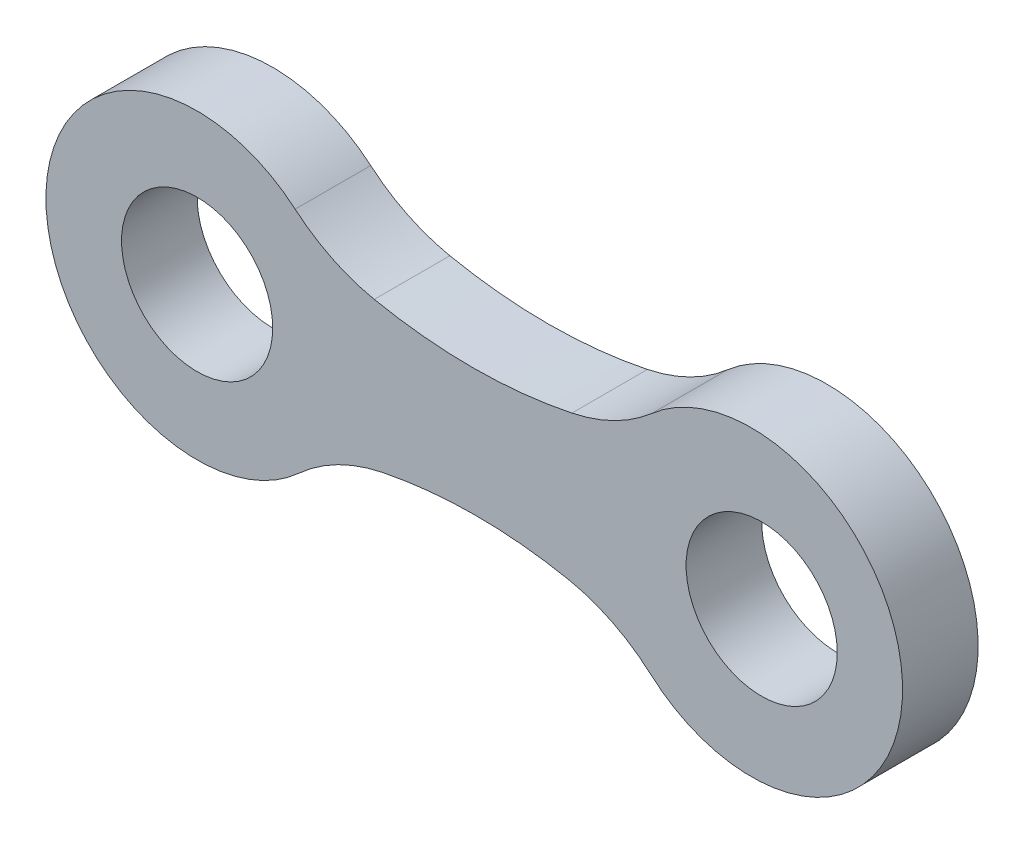
from build123d import *

# Parameters (mm, degrees)
BOSS_EXTRUDE1_DEPTH = 3
SKETCH2_R           = 3
CUT_EXTRUDE1_DEPTH  = 3


with BuildPart() as part:
    # Sketch1 → Boss-Extrude1 (new body)
    with BuildSketch(Plane.XY):
        with BuildLine():
            ThreePointArc((-38.993072638, 10.297497813), (-29.003536718, 14.749442663), (-38.948867239, 19.299282405))
            ThreePointArc((-38.948867239, 19.299282405), (-40.43645285, 18.304531068), (-42.127647344, 17.719464956))
            ThreePointArc((-42.127647344, 17.719464956), (-46.049056408, 17.312851184), (-49.971869959, 17.705684038))
            ThreePointArc((-49.971869959, 17.705684038), (-51.638902703, 18.27196215), (-53.111913064, 19.236280328))
            ThreePointArc((-53.111913064, 19.236280328), (-63.002628538, 14.569315621), (-52.961652305, 10.235078841))
            ThreePointArc((-52.961652305, 10.235078841), (-51.409870812, 11.305926496), (-49.628578883, 11.923777258))
            ThreePointArc((-49.628578883, 11.923777258), (-45.958785243, 12.292784959), (-42.287798819, 11.935838578))
            ThreePointArc((-42.287798819, 11.935838578), (-40.530859131, 11.337028267), (-38.993072638, 10.297497813))
        make_face()
    extrude(amount=BOSS_EXTRUDE1_DEPTH)

    # Sketch2 → Cut-Extrude1 (cut)
    with BuildSketch(Plane.XY.offset(3)):
        with Locations((-57.001914988, 14.704587642)):
            Circle(SKETCH2_R)
        with Locations((-34.595484072, 14.749442663)):
            Circle(SKETCH2_R)
    extrude(amount=-CUT_EXTRUDE1_DEPTH, mode=Mode.SUBTRACT)


solid = part.part
